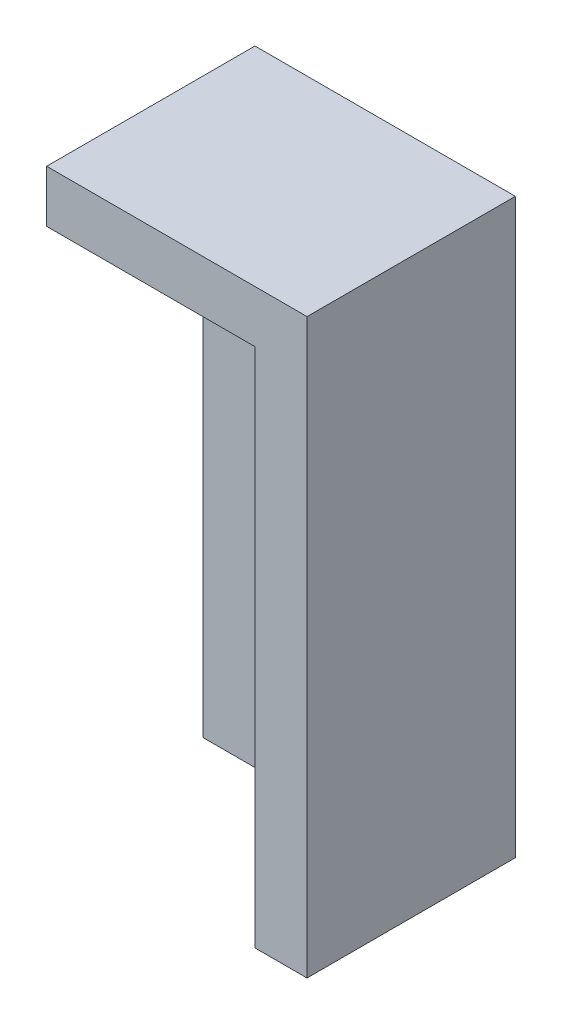
from build123d import *

# Parameters (mm, degrees)
SKETCH1_W           = 55
SKETCH1_H           = 25
BOSS_EXTRUDE1_DEPTH = 5
BOSS_EXTRUDE2_DEPTH = 15


with BuildPart() as part:
    # Sketch1 → Boss-Extrude1 (new body)
    with BuildSketch(Plane(origin=(0, 0, 0), x_dir=(0, 1, 0), z_dir=(0, 0, 1))):
        with Locations((-8.366983373, -9.709026128)):
            Rectangle(SKETCH1_W, SKETCH1_H)
    extrude(amount=BOSS_EXTRUDE1_DEPTH)

    # Sketch3 → Boss-Extrude2 (add)
    with BuildSketch(Plane.XY.offset(5)):
        Polygon((-2.790973872, 14.133016627), (-2.790973872, 19.133016627), (22.209026128, 19.133016627), (22.209026128, -35.866983373), (17.209026128, -35.866983373), (17.209026128, 14.133016627), align=None)
    extrude(amount=BOSS_EXTRUDE2_DEPTH)


solid = part.part
